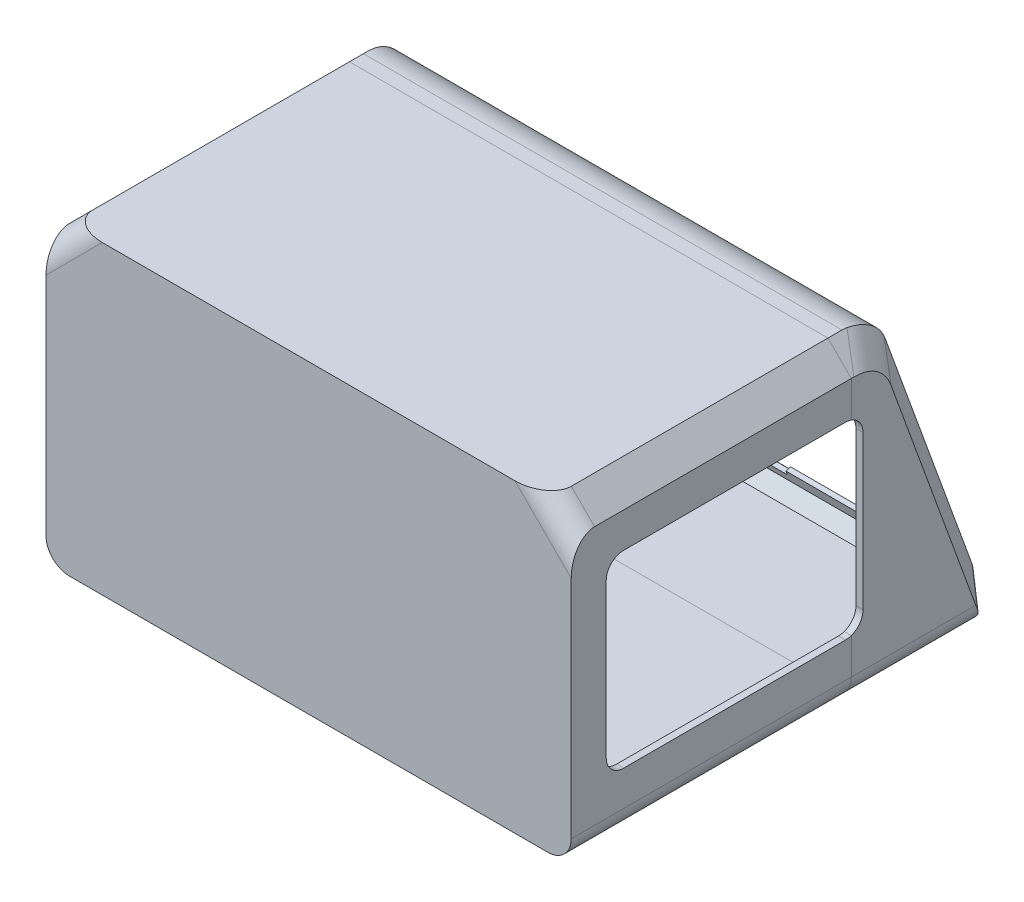
from build123d import *

# Parameters (mm, degrees)
SKETCH1_W           = 225
SKETCH1_H           = 130.8
BOSS_EXTRUDE1_DEPTH = 140
BOSS_EXTRUDE2_DEPTH = 225
CHAMFER1_SIZE       = 10
FILLET1_R           = 10
FILLET2_R           = 20
FILLET3_R           = 24
CHAMFER2_SIZE       = 10
CHAMFER2_SIZE2      = 7.802060087
FILLET4_R           = 12.5
FILLET5_R           = 10
SHELL1_T            = 3
SKETCH3_W           = 110
SKETCH3_H           = 80.8
CUT_EXTRUDE1_DEPTH  = 3
FILLET6_R           = 7.5
CUT_EXTRUDE2_DEPTH  = 1
CUT_EXTRUDE3_REACH  = 212.374
SKETCH6_W           = 53
SKETCH6_H           = 3
SKETCH6_W_2         = 167
SKETCH6_H_2         = 101.4


with BuildPart() as part:
    # Sketch1 → Boss-Extrude1 (new body)
    with BuildSketch(Plane.XY):
        with Locations((6, 0)):
            Rectangle(SKETCH1_W, SKETCH1_H)
    extrude(amount=BOSS_EXTRUDE1_DEPTH)

    # Sketch2 → Boss-Extrude2 (add)
    with BuildSketch(Plane.ZY.offset(106.5)):
        Polygon((-47.607306642, -65.4), (0, 65.4), (0, -65.4), align=None)
    extrude(amount=-BOSS_EXTRUDE2_DEPTH)

    # Chamfer1
    chamfer1_edges = [part.edges().sort_by_distance(p)[0] for p in [
        (118.5, 0, -23.803653321),
        (-106.5, 0, -23.803653321),
        (118.5, 65.4, 70),
        (-106.5, 65.4, 70),
    ]]
    chamfer(chamfer1_edges, length=CHAMFER1_SIZE)

    # Fillet1
    fillet1_edges = [part.edges().sort_by_distance(p)[0] for p in [
        (113.5, 60.4, 140),
        (-101.5, 60.4, 140),
    ]]
    fillet(fillet1_edges, radius=FILLET1_R)

    # Fillet2
    fillet2_edges = [part.edges().sort_by_distance(p)[0] for p in [
        (6, 65.4, 0),
    ]]
    fillet(fillet2_edges, radius=FILLET2_R)

    # Fillet3
    fillet3_edges = [part.edges().sort_by_distance(p)[0] for p in [
        (-103.308479557, 58.591520443, 4.76734871),
        (115.308479557, 58.591520443, 4.76734871),
    ]]
    fillet(fillet3_edges, radius=FILLET3_R)

    # Chamfer2
    chamfer2_edges = [part.edges().sort_by_distance(p)[0] for p in [
        (6, -65.4, -47.607306642),
    ]]
    chamfer2_side = [part.faces().sort_by_distance(p)[0] for p in [
        (6, -65.4, 46.424462894),
    ]]
    chamfer(chamfer2_edges, length=CHAMFER2_SIZE, length2=CHAMFER2_SIZE2, reference=chamfer2_side[0])

    # Fillet4
    fillet4_edges = [part.edges().sort_by_distance(p)[0] for p in [
        (113.198463104, -61.734230855, -41.273075787),
        (-101.198463104, -61.734230855, -41.273075787),
    ]]
    fillet(fillet4_edges, radius=FILLET4_R)

    # Fillet5
    fillet5_edges = [part.edges().sort_by_distance(p)[0] for p in [
        (-106.5, -65.4, 53.126939576),
        (118.5, -65.4, 53.126939576),
    ]]
    fillet(fillet5_edges, radius=FILLET5_R)

    # Shell1 (no face opened: a closed hollow body)
    add(offset(amount=-SHELL1_T, mode=Mode.PRIVATE), mode=Mode.SUBTRACT)

    # Sketch3 → Cut-Extrude1 (cut)
    with BuildSketch(Plane(origin=(118.5, 0, 0), x_dir=(0, 0, -1), z_dir=(1, 0, 0))):
        with Locations((-70, 0)):
            Rectangle(SKETCH3_W, SKETCH3_H)
    extrude(amount=-CUT_EXTRUDE1_DEPTH, mode=Mode.SUBTRACT)

    # Fillet6
    fillet6_edges = [part.edges().sort_by_distance(p)[0] for p in [
        (117, 40.4, 125),
        (117, 40.4, 15),
        (117, -40.4, 15),
        (117, -40.4, 125),
    ]]
    fillet(fillet6_edges, radius=FILLET6_R)

    # Sketch5 → Cut-Extrude2 (cut)
    with BuildSketch(Plane(origin=(0, 7.65034671, -21.019154837), x_dir=(-1, 0, 0), z_dir=(0, 0.3420201433256695, -0.9396926207859082))):
        with BuildLine():
            Line((90.85, -59.642374259), (90.85, 37.157625741))
            ThreePointArc((90.85, 37.157625741), (88.697234842, 42.354860583), (83.5, 44.507625741))
            Line((83.5, 44.507625741), (-95.5, 44.507625741))
            ThreePointArc((-95.5, 44.507625741), (-100.697234842, 42.354860583), (-102.85, 37.157625741))
            Line((-102.85, 37.157625741), (-102.85, -59.642374259))
            ThreePointArc((-102.85, -59.642374259), (-100.697234842, -64.839609101), (-95.5, -66.992374259))
            Line((-95.5, -66.992374259), (83.5, -66.992374259))
            ThreePointArc((83.5, -66.992374259), (88.697234842, -64.839609101), (90.85, -59.642374259))
        make_face()
    extrude(amount=-CUT_EXTRUDE2_DEPTH, mode=Mode.SUBTRACT)

    # Sketch6 → Cut-Extrude3 (cut, up to next)
    with BuildSketch(Plane(origin=(0, 6.62428628, -18.200076974), x_dir=(1, 0, 0), z_dir=(0, -0.3420201433256695, 0.9396926207859082)), mode=Mode.PRIVATE) as cut_extrude3_sk1:
        with Locations((4.2, -63.492374259)):
            Rectangle(SKETCH6_W, SKETCH6_H)
    cut_extrude3_tool1 = extrude(cut_extrude3_sk1.sketch, amount=-CUT_EXTRUDE3_REACH, mode=Mode.PRIVATE) & part.part
    # Sketch6 → Cut-Extrude3 (cut, up to next)
    with BuildSketch(Plane(origin=(0, 6.62428628, -18.200076974), x_dir=(1, 0, 0), z_dir=(0, -0.3420201433256695, 0.9396926207859082)), mode=Mode.PRIVATE) as cut_extrude3_sk2:
        with Locations((4.25, -12.492374259)):
            Rectangle(SKETCH6_W_2, SKETCH6_H_2)
    cut_extrude3_tool2 = extrude(cut_extrude3_sk2.sketch, amount=-CUT_EXTRUDE3_REACH, mode=Mode.PRIVATE) & part.part
    add(cut_extrude3_tool1.solids().sort_by_distance((4.2, -53.039029, -39.915748))[0], mode=Mode.SUBTRACT)
    add(cut_extrude3_tool2.solids().sort_by_distance((4.25, -5.114706, -22.472721))[0], mode=Mode.SUBTRACT)


with BuildPart() as body_2:
    # Split1: the piece on the far side of the plane
    add(part.part)
    split(bisect_by=Plane.XY.offset(20), keep=Keep.BOTTOM)


with BuildPart() as part_1:
    add(part.part)

    # Split1
    split(bisect_by=Plane.XY.offset(20), keep=Keep.TOP)


solid = Compound([body_2.part, part_1.part])
